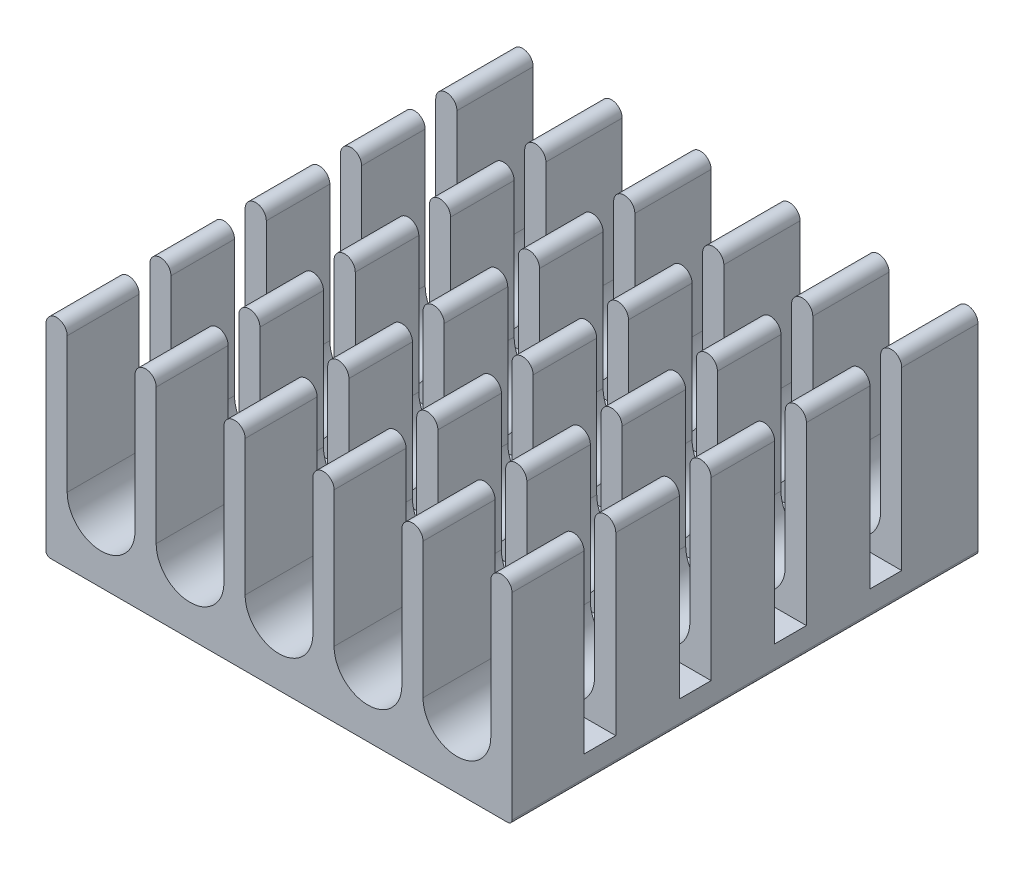
from build123d import *

# Parameters (mm, degrees)
SKETCH_1_W          = 22
SKETCH_1_H          = 22
EXTRUDE_1_DEPTH     = 10
CUT_EXTRUDE_1_DEPTH = 33.680269277
CUT_EXTRUDE_2_DEPTH = 55.800858661
CUT_EXTRUDE_4_DEPTH = 55.800858661
FILLET_1_R          = 0.2


with BuildPart() as part:
    # 草图1 → 凸台-拉伸1 (new body)
    with BuildSketch(Plane(origin=(0, 0, 0), x_dir=(1, 0, 0), z_dir=(0, 1, 0))):
        with Locations((38.184693859, 11)):
            Rectangle(SKETCH_1_W, SKETCH_1_H)
    extrude(amount=EXTRUDE_1_DEPTH)

    # 草图2 → 切除-拉伸1 (cut, through all)
    with BuildSketch(Plane.ZY.offset(-27.184693859)):
        Polygon((-18.4, 10), (-16.9, 10), (-16.9, 1.7), (-16.9, 1.2), (-17.65, 1.2), (-18.4, 1.2), (-18.4, 1.7), align=None)
        Polygon((-3.4, 10), (-3.4, 1.7), (-3.4, 1.2), (-4.9, 1.2), (-4.9, 1.7), (-4.9, 10), align=None)
        Polygon((-13.9, 10), (-12.4, 10), (-12.4, 1.7), (-12.4, 1.2), (-13.9, 1.2), (-13.9, 1.7), align=None)
        Polygon((-7.9, 10), (-7.9, 1.7), (-7.9, 1.2), (-9.4, 1.2), (-9.4, 1.7), (-9.4, 10), align=None)
    extrude(amount=-CUT_EXTRUDE_1_DEPTH, mode=Mode.SUBTRACT)

    # 草图3 → 切除-拉伸2 (cut, through all)
    with BuildSketch(Plane.XY):
        with BuildLine():
            Line((43.984693859, 3.1), (43.984693859, 10))
            Line((43.984693859, 10), (40.784693859, 10))
            Line((40.784693859, 10), (40.784693859, 3.1))
            ThreePointArc((40.784693859, 3.1), (42.384693859, 1.5), (43.984693859, 3.1))
        make_face()
        with BuildLine():
            Line((39.784693859, 3.1), (39.784693859, 10))
            Line((39.784693859, 10), (36.584693859, 10))
            Line((36.584693859, 10), (36.584693859, 3.1))
            ThreePointArc((36.584693859, 3.1), (38.184693859, 1.5), (39.784693859, 3.1))
        make_face()
        with BuildLine():
            Line((48.184693859, 3.1), (48.184693859, 10))
            Line((48.184693859, 10), (44.984693859, 10))
            Line((44.984693859, 10), (44.984693859, 3.1))
            ThreePointArc((44.984693859, 3.1), (46.584693859, 1.5), (48.184693859, 3.1))
        make_face()
        with BuildLine():
            Line((35.584693859, 3.1), (35.584693859, 10))
            Line((35.584693859, 10), (32.384693859, 10))
            Line((32.384693859, 10), (32.384693859, 3.1))
            ThreePointArc((32.384693859, 3.1), (33.984693859, 1.5), (35.584693859, 3.1))
        make_face()
        with BuildLine():
            Line((31.384693859, 3.1), (31.384693859, 10))
            Line((31.384693859, 10), (28.184693859, 10))
            Line((28.184693859, 10), (28.184693859, 3.1))
            ThreePointArc((28.184693859, 3.1), (29.784693859, 1.5), (31.384693859, 3.1))
        make_face()
    extrude(amount=-CUT_EXTRUDE_2_DEPTH, mode=Mode.SUBTRACT)

    # 草图4 → 切除-拉伸4 (cut, through all)
    with BuildSketch(Plane.XY):
        with BuildLine():
            Line((49.184693859, 10), (48.684693854, 10))
            ThreePointArc((48.684693854, 10), (49.038247248, 9.853553392), (49.184693859, 9.5))
            Line((49.184693859, 9.5), (49.184693859, 10))
        make_face()
        with BuildLine():
            Line((48.184693859, 10), (48.184693859, 9.5))
            ThreePointArc((48.184693859, 9.5), (48.331140466, 9.853553389), (48.684693854, 10))
            Line((48.684693854, 10), (48.184693859, 10))
        make_face()
        with BuildLine():
            Line((44.984693859, 10), (44.484693859, 10))
            ThreePointArc((44.484693859, 10), (44.838247249, 9.853553391), (44.984693859, 9.5))
            Line((44.984693859, 9.5), (44.984693859, 10))
        make_face()
        with BuildLine():
            Line((43.984693859, 10), (43.984693859, 9.5))
            ThreePointArc((43.984693859, 9.5), (44.131140468, 9.853553391), (44.484693859, 10))
            Line((44.484693859, 10), (43.984693859, 10))
        make_face()
        with BuildLine():
            Line((40.784693859, 10), (40.284693859, 10))
            ThreePointArc((40.284693859, 10), (40.638247249, 9.853553391), (40.784693859, 9.5))
            Line((40.784693859, 9.5), (40.784693859, 10))
        make_face()
        with BuildLine():
            Line((39.784693859, 10), (39.784693859, 9.5))
            ThreePointArc((39.784693859, 9.5), (39.931140468, 9.853553391), (40.284693859, 10))
            Line((40.284693859, 10), (39.784693859, 10))
        make_face()
        with BuildLine():
            Line((36.584693859, 10), (36.084693859, 10))
            ThreePointArc((36.084693859, 10), (36.438247249, 9.853553391), (36.584693859, 9.5))
            Line((36.584693859, 9.5), (36.584693859, 10))
        make_face()
        with BuildLine():
            Line((35.584693859, 10), (35.584693859, 9.5))
            ThreePointArc((35.584693859, 9.5), (35.731140468, 9.853553391), (36.084693859, 10))
            Line((36.084693859, 10), (35.584693859, 10))
        make_face()
        with BuildLine():
            Line((32.384693859, 10), (31.884693854, 10))
            ThreePointArc((31.884693854, 10), (32.238247248, 9.853553392), (32.384693859, 9.5))
            Line((32.384693859, 9.5), (32.384693859, 10))
        make_face()
        with BuildLine():
            Line((31.384693859, 10), (31.384693859, 9.5))
            ThreePointArc((31.384693859, 9.5), (31.531140466, 9.853553389), (31.884693854, 10))
            Line((31.884693854, 10), (31.384693859, 10))
        make_face()
        with BuildLine():
            Line((28.184693859, 10), (27.684693859, 10))
            ThreePointArc((27.684693859, 10), (28.038247249, 9.853553391), (28.184693859, 9.5))
            Line((28.184693859, 9.5), (28.184693859, 10))
        make_face()
        with BuildLine():
            Line((27.184693859, 10), (27.184693859, 9.5))
            ThreePointArc((27.184693859, 9.5), (27.331140468, 9.853553391), (27.684693859, 10))
            Line((27.684693859, 10), (27.184693859, 10))
        make_face()
    extrude(amount=-CUT_EXTRUDE_4_DEPTH, mode=Mode.SUBTRACT)

    # 圆角1
    fillet_1_edges = [part.edges().sort_by_distance(p)[0] for p in [
        (49.184693859, 0, -11),
        (27.184693859, 0, -11),
    ]]
    fillet(fillet_1_edges, radius=FILLET_1_R)


solid = part.part
